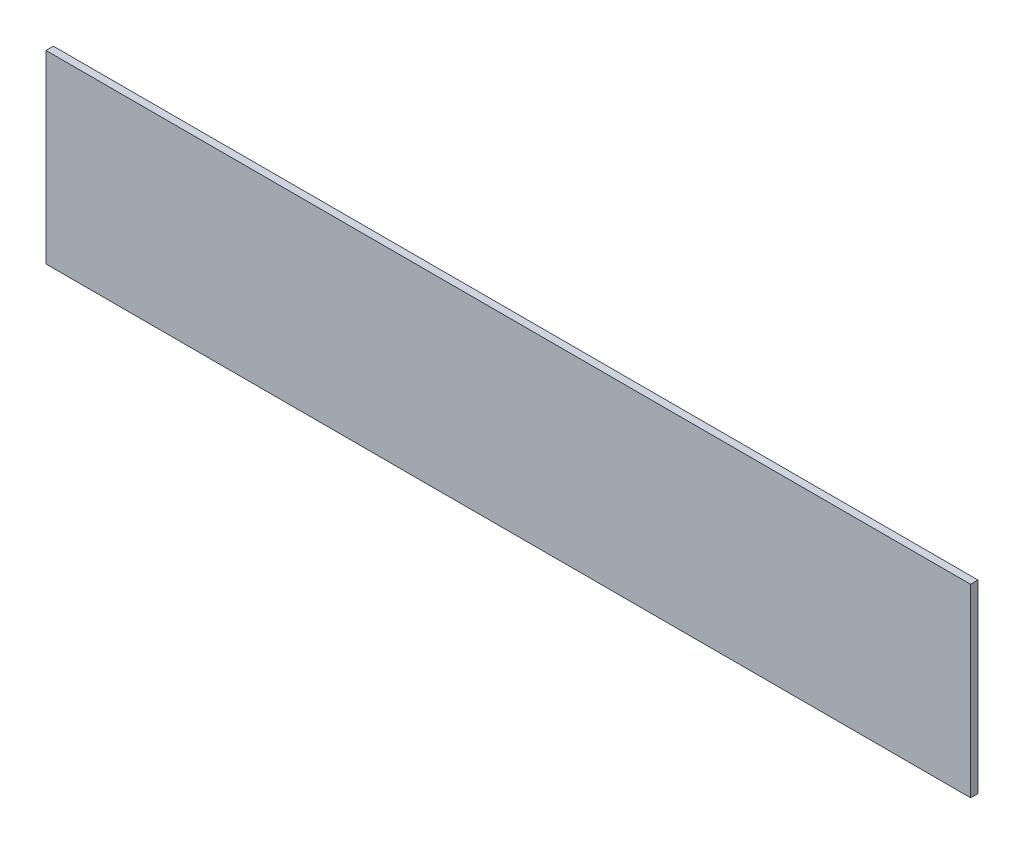
from build123d import *

# Parameters (mm, degrees)
ESBO_O1_W                = 25
ESBO_O1_H                = 5
RESSALTO_EXTRUS_O1_DEPTH = 0.2


with BuildPart() as part:
    # Esboço1 → Ressalto-extrusão1 (new body)
    with BuildSketch(Plane.XY):
        Rectangle(ESBO_O1_W, ESBO_O1_H)
    extrude(amount=RESSALTO_EXTRUS_O1_DEPTH)


solid = part.part
